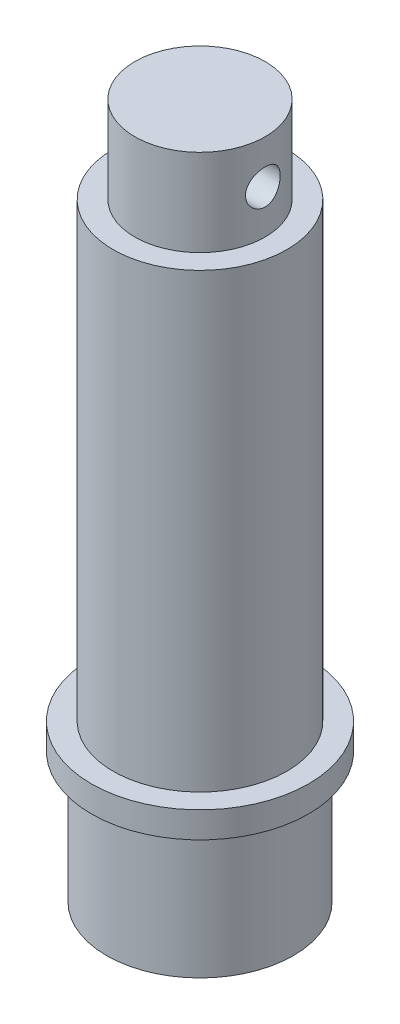
from build123d import *

# Parameters (mm, degrees)
SKETCH2_R               = 10
BOSS_EXTRUDE1_DEPTH     = 30
CUT_EXTRUDE1_START      = -10
SKETCH3_R               = 10
SKETCH3_R_2             = 7.5
CUT_EXTRUDE1_DEPTH      = 10
CUT_EXTRUDE3_DEPTH      = 10
CUT_EXTRUDE3_DEPTH_BACK = 10
SKETCH5_R               = 2
FILLET2_R               = 10
BOSS_EXTRUDE2_START     = -67.5
SKETCH7_R               = 10
BOSS_EXTRUDE2_DEPTH     = 67.5
SKETCH8_R               = 50
SKETCH8_R_2             = 10
CUT_EXTRUDE6_DEPTH      = 107.770782567
SKETCH10_R              = 10.75
SKETCH10_R_2            = 10
BOSS_EXTRUDE3_DEPTH     = 15
SKETCH11_R              = 12.5
BOSS_EXTRUDE4_DEPTH     = 3


with BuildPart() as part:
    # Sketch1 → Revolve1 (revolve)
    with BuildSketch(Plane.XY):
        Polygon((50, 25), (0, 25), (0, 22.5), (45, 22.5), (45, -22.5), (0, -22.5), (0, -25), (50, -25), align=None)
    revolve(axis=Axis((0, -25, 0), (0, 1, 0)))

    # Sketch2 → Boss-Extrude1 (add)
    with BuildSketch(Plane(origin=(0, 25, 0), x_dir=(1, 0, 0), z_dir=(0, 1, 0))):
        with Locations(Location((0, 0, 0), (0, 0, 180))):
            Circle(SKETCH2_R)
    extrude(amount=BOSS_EXTRUDE1_DEPTH)

    # Sketch3 → Cut-Extrude1 (cut)
    with BuildSketch(Plane(origin=(0, 55, 0), x_dir=(1, 0, 0), z_dir=(0, 1, 0)).offset(CUT_EXTRUDE1_START)):
        with Locations(Location((0, 0, 0), (0, 0, 180))):
            Circle(SKETCH3_R)
        with Locations(Location((0, 0, 0), (0, 0, 180))):
            Circle(SKETCH3_R_2, mode=Mode.SUBTRACT)
    extrude(amount=CUT_EXTRUDE1_DEPTH, mode=Mode.SUBTRACT)

    # Sketch5 → Cut-Extrude3 (cut, two sides: drawn at the far end of the back side and taken through both)
    with BuildSketch(Plane(origin=(0, 0, 0), x_dir=(0, 0, -1), z_dir=(1, 0, 0)).offset(-CUT_EXTRUDE3_DEPTH_BACK)):
        with Locations(Location((0, 50, 0), (0, 0, 180))):
            Circle(SKETCH5_R)
    extrude(amount=CUT_EXTRUDE3_DEPTH + CUT_EXTRUDE3_DEPTH_BACK, mode=Mode.SUBTRACT)

    # Fillet2
    fillet2_edges = [part.edges().sort_by_distance(p)[0] for p in [
        (-50, 25, 0),
    ]]
    fillet(fillet2_edges, radius=FILLET2_R)

    # Sketch7 → Boss-Extrude2 (add)
    with BuildSketch(Plane(origin=(0, 45, 0), x_dir=(1, 0, 0), z_dir=(0, 1, 0)).offset(BOSS_EXTRUDE2_START)):
        with Locations(Location((0, 0, 0), (0, 0, 180))):
            Circle(SKETCH7_R)
    extrude(amount=BOSS_EXTRUDE2_DEPTH)

    # Sketch8 → Cut-Extrude6 (cut, through all)
    with BuildSketch(Plane(origin=(0, 55, 0), x_dir=(1, 0, 0), z_dir=(0, 1, 0))):
        Circle(SKETCH8_R)
        with Locations(Location((0, 0, 0), (0, 0, 180))):
            Circle(SKETCH8_R_2, mode=Mode.SUBTRACT)
    extrude(amount=-CUT_EXTRUDE6_DEPTH, mode=Mode.SUBTRACT)

    # Sketch10 → Boss-Extrude3 (add)
    with BuildSketch(Plane.XZ.offset(25)):
        Circle(SKETCH10_R)
        Circle(SKETCH10_R_2, mode=Mode.SUBTRACT)
    extrude(amount=-BOSS_EXTRUDE3_DEPTH)

    # Sketch11 → Boss-Extrude4 (add)
    with BuildSketch(Plane(origin=(0, -10, 0), x_dir=(1, 0, 0), z_dir=(0, 1, 0))):
        with Locations(Location((0, 0, 0), (0, 0, 180))):
            Circle(SKETCH11_R)
    extrude(amount=BOSS_EXTRUDE4_DEPTH)


solid = part.part
